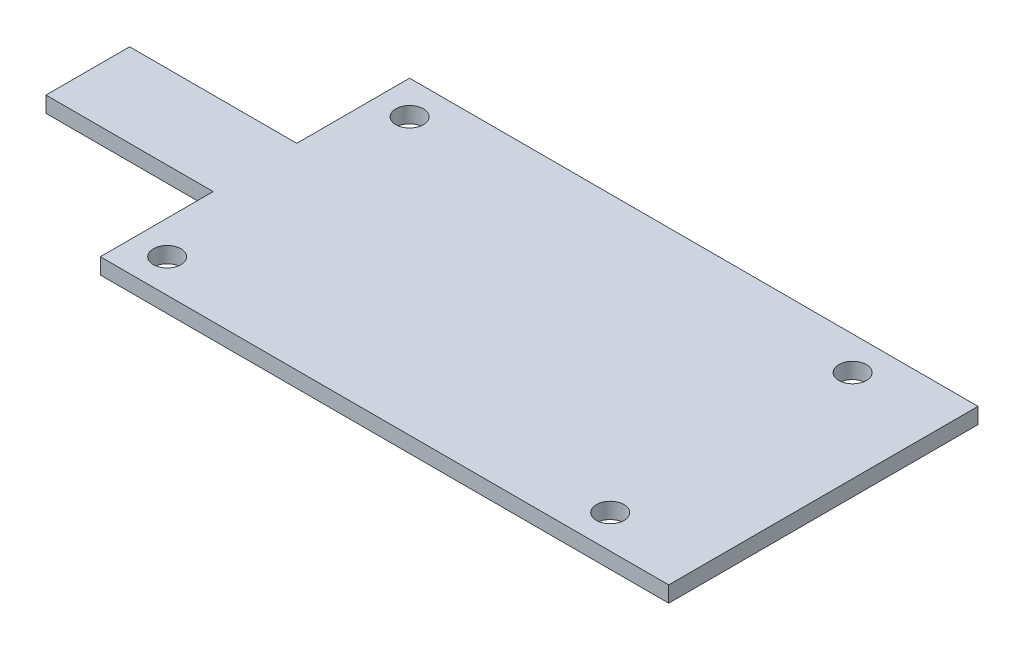
from build123d import *

# Parameters (mm, degrees)
SKETCH1_R           = 1.65
BOSS_EXTRUDE1_DEPTH = 1.9


with BuildPart() as part:
    # Sketch1 → Boss-Extrude1 (new body)
    with BuildSketch(Plane(origin=(0, 0, 0), x_dir=(1, 0, 0), z_dir=(0, 1, 0))):
        Polygon((-30.5, 18.5), (30.5, 18.5), (37.5, 18.5), (37.5, -18.5), (30.5, -18.5), (-30.5, -18.5), (-30.5, -5), (-50.5, -5), (-50.5, 5), (-30.5, 5), align=None)
        with Locations(Location((-26.5, 14.5, 0), (0, 0, 90))):
            Circle(SKETCH1_R, mode=Mode.SUBTRACT)
        with Locations(Location((26.5, 14.5, 0), (0, 0, 90))):
            Circle(SKETCH1_R, mode=Mode.SUBTRACT)
        with Locations(Location((26.5, -14.5, 0), (0, 0, 90))):
            Circle(SKETCH1_R, mode=Mode.SUBTRACT)
        with Locations(Location((-26.5, -14.5, 0), (0, 0, 90))):
            Circle(SKETCH1_R, mode=Mode.SUBTRACT)
    extrude(amount=BOSS_EXTRUDE1_DEPTH)


solid = part.part
